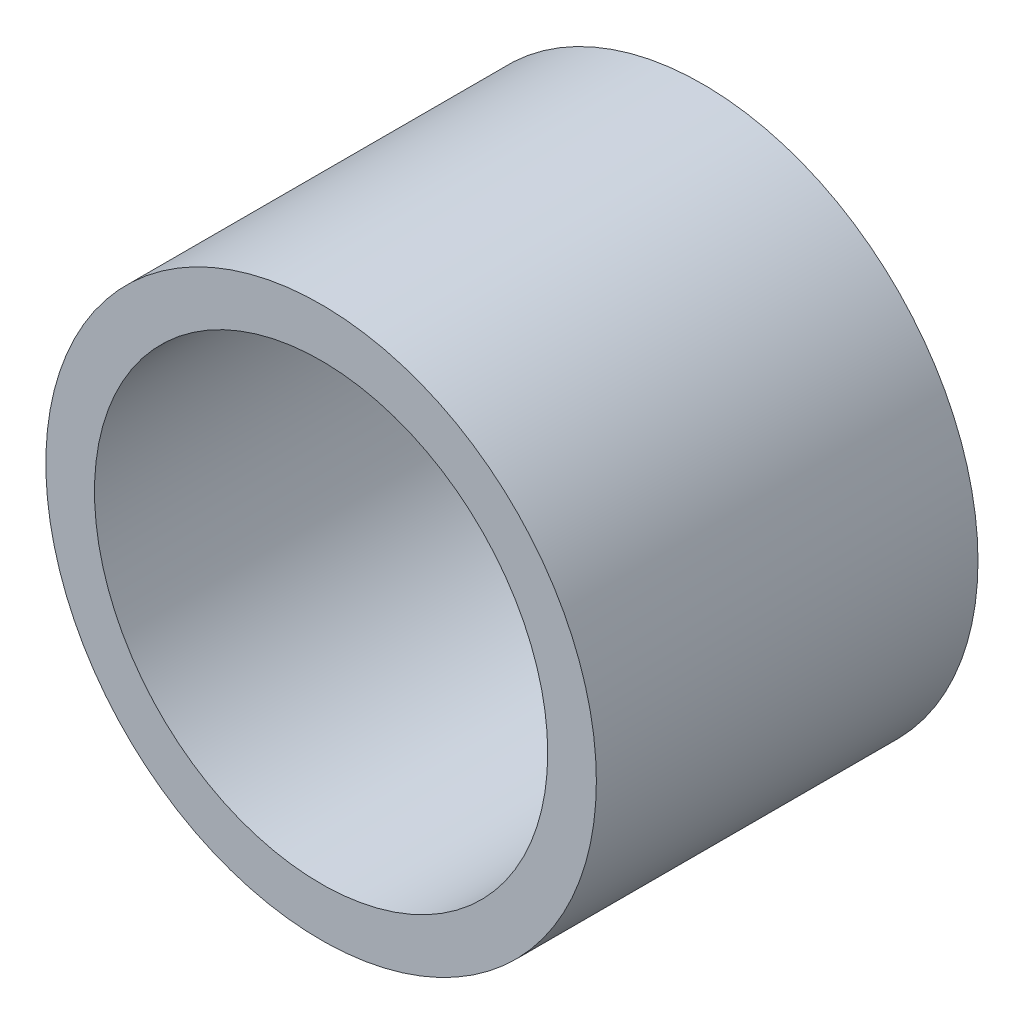
from build123d import *

# Parameters (mm, degrees)
SKETCH1_R           = 15.8115
BOSS_EXTRUDE1_DEPTH = 21.9202
SKETCH2_R           = 13.0175
CUT_EXTRUDE1_DEPTH  = 19.3294
FILLET1_R           = 0.3175


with BuildPart() as part:
    # Sketch1 → Boss-Extrude1 (new body)
    with BuildSketch(Plane.XY):
        Circle(SKETCH1_R)
    extrude(amount=BOSS_EXTRUDE1_DEPTH)

    # Sketch2 → Cut-Extrude1 (cut)
    with BuildSketch(Plane.XY.offset(21.9202)):
        Circle(SKETCH2_R)
    extrude(amount=-CUT_EXTRUDE1_DEPTH, mode=Mode.SUBTRACT)

    # Fillet1
    fillet1_edges = [part.edges().sort_by_distance(p)[0] for p in [
        (-13.0175, 0, 2.5908),
    ]]
    fillet(fillet1_edges, radius=FILLET1_R)


solid = part.part
